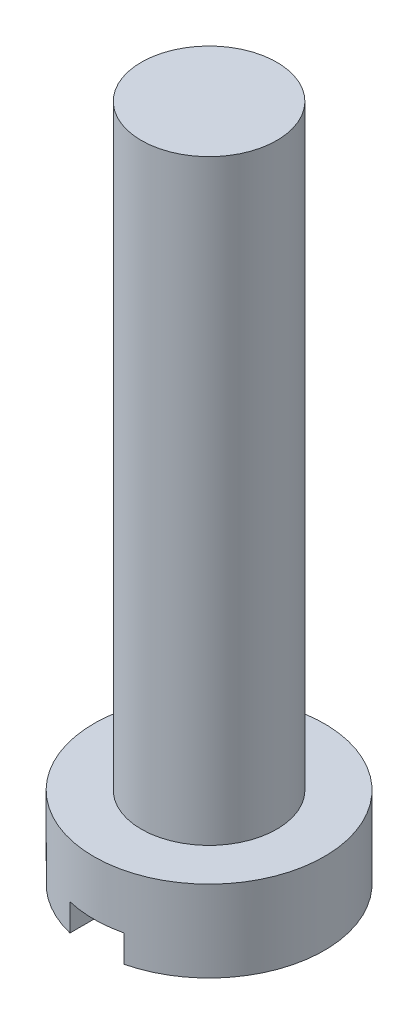
from build123d import *

# Parameters (mm, degrees)
ESQUISSE1_R             = 4.25
ESQUISSE1_R_2           = 2.5
BOSS_EXTRU_1_DEPTH      = 3
ESQUISSE1_4_R           = 2.5
BOSS_EXTRU_3_DEPTH      = 25
ENL_V_MAT_EXTRU_1_DEPTH = 1


with BuildPart() as part:
    # Esquisse1 → Boss.-Extru.1 (new body)
    with BuildSketch(Plane(origin=(0, 0, 0), x_dir=(1, 0, 0), z_dir=(0, 1, 0))):
        Circle(ESQUISSE1_R)
        Circle(ESQUISSE1_R_2, mode=Mode.SUBTRACT)
    extrude(amount=BOSS_EXTRU_1_DEPTH)

    # Esquisse1<4> → Boss.-Extru.3 (add)
    with BuildSketch(Plane(origin=(0, 0, 0), x_dir=(1, 0, 0), z_dir=(0, 1, 0))):
        Circle(ESQUISSE1_4_R)
    extrude(amount=BOSS_EXTRU_3_DEPTH)

    # Esquisse2 → Enlèv. mat.-Extru.1 (cut)
    with BuildSketch(Plane.XZ):
        Polygon((-1, 0), (-1, 8), (1, 8), (1, -8), (-1, -8), align=None)
    extrude(amount=-ENL_V_MAT_EXTRU_1_DEPTH, mode=Mode.SUBTRACT)


solid = part.part
